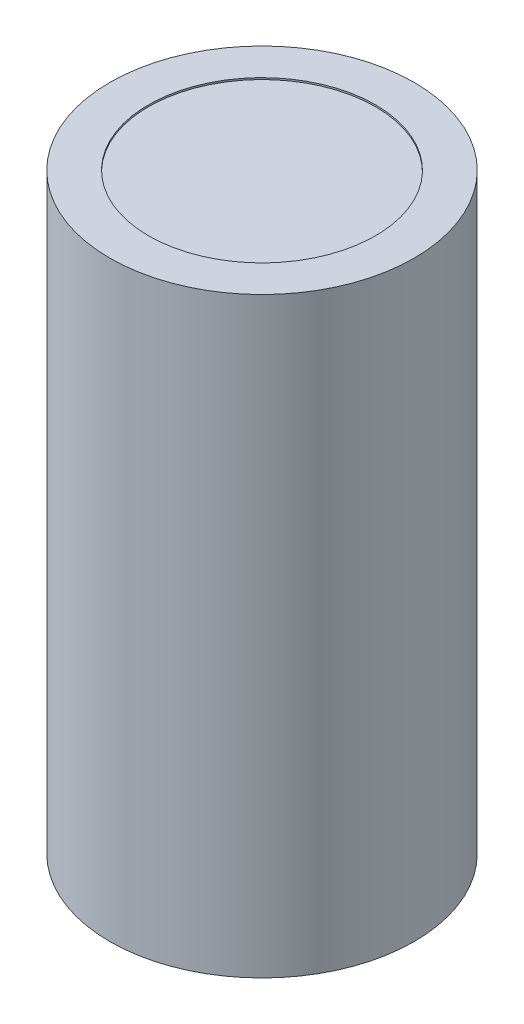
from build123d import *

# Parameters (mm, degrees)
SKETCH1_R           = 9
BOSS_EXTRUDE1_DEPTH = 35
SKETCH2_R           = 6.711393828
CUT_EXTRUDE1_DEPTH  = 0.1
SKETCH3_R           = 7.318356246
CUT_EXTRUDE2_DEPTH  = 0.1


with BuildPart() as part:
    # Sketch1 → Boss-Extrude1 (new body)
    with BuildSketch(Plane(origin=(0, 0, 0), x_dir=(1, 0, 0), z_dir=(0, 1, 0))):
        with Locations(Location((0, 0, 0), (0, 0, 270))):
            Circle(SKETCH1_R)
    extrude(amount=BOSS_EXTRUDE1_DEPTH)

    # Sketch2 → Cut-Extrude1 (cut)
    with BuildSketch(Plane(origin=(0, 35, 0), x_dir=(1, 0, 0), z_dir=(0, 1, 0))):
        with Locations(Location((0, 0, 0), (0, 0, 270))):
            Circle(SKETCH2_R)
    extrude(amount=-CUT_EXTRUDE1_DEPTH, mode=Mode.SUBTRACT)

    # Sketch3 → Cut-Extrude2 (cut)
    with BuildSketch(Plane.XZ):
        with Locations(Location((0, 0, 0), (0, 0, 270))):
            Circle(SKETCH3_R)
    extrude(amount=-CUT_EXTRUDE2_DEPTH, mode=Mode.SUBTRACT)


solid = part.part
